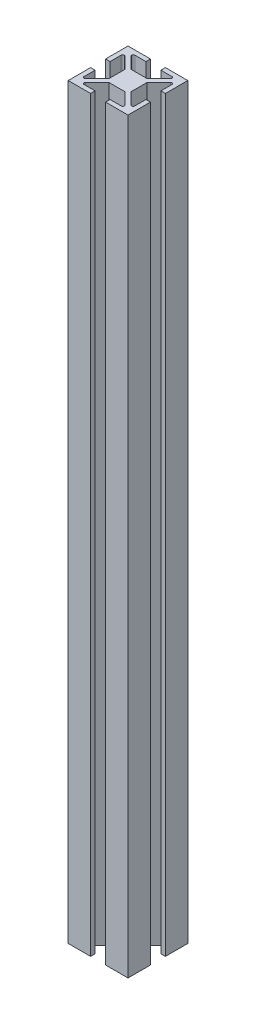
from build123d import *

# Parameters (mm, degrees)
BOSS_EXTRU_1_DEPTH = 250


with BuildPart() as part:
    # Esquisse1 → Boss.-Extru.1 (new body)
    with BuildSketch(Plane(origin=(0, 0, 0), x_dir=(1, 0, 0), z_dir=(0, 1, 0))):
        with BuildLine():
            Line((-10, -2.5), (-10, -10))
            Line((-10, -10), (-2.5, -10))
            Line((-2.5, -10), (-2.5, -8.5))
            Line((-2.5, -8.5), (-6.232233047, -8.5))
            ThreePointArc((-6.232233047, -8.5), (-6.694172813, -8.191341716), (-6.585786438, -7.646446609))
            Line((-6.585786438, -7.646446609), (-2.689339828, -3.75))
            Line((-2.689339828, -3.75), (2.689339828, -3.75))
            Line((2.689339828, -3.75), (6.585786438, -7.646446609))
            ThreePointArc((6.585786438, -7.646446609), (6.694172813, -8.191341716), (6.232233047, -8.5))
            Line((6.232233047, -8.5), (2.5, -8.5))
            Line((2.5, -8.5), (2.5, -10))
            Line((2.5, -10), (10, -10))
            Line((10, -10), (10, -2.5))
            Line((10, -2.5), (8.5, -2.5))
            Line((8.5, -2.5), (8.5, -6.232233047))
            ThreePointArc((8.5, -6.232233047), (8.191341716, -6.694172813), (7.646446609, -6.585786438))
            Line((7.646446609, -6.585786438), (3.75, -2.689339828))
            Line((3.75, -2.689339828), (3.75, 2.689339828))
            Line((3.75, 2.689339828), (7.646446609, 6.585786438))
            ThreePointArc((7.646446609, 6.585786438), (8.191341716, 6.694172813), (8.5, 6.232233047))
            Line((8.5, 6.232233047), (8.5, 2.5))
            Line((8.5, 2.5), (10, 2.5))
            Line((10, 2.5), (10, 10))
            Line((10, 10), (2.5, 10))
            Line((2.5, 10), (2.5, 8.5))
            Line((2.5, 8.5), (6.232233047, 8.5))
            ThreePointArc((6.232233047, 8.5), (6.694172813, 8.191341716), (6.585786438, 7.646446609))
            Line((6.585786438, 7.646446609), (2.689339828, 3.75))
            Line((2.689339828, 3.75), (-2.689339828, 3.75))
            Line((-2.689339828, 3.75), (-6.585786438, 7.646446609))
            ThreePointArc((-6.585786438, 7.646446609), (-6.694172813, 8.191341716), (-6.232233047, 8.5))
            Line((-6.232233047, 8.5), (-2.5, 8.5))
            Line((-2.5, 8.5), (-2.5, 10))
            Line((-2.5, 10), (-10, 10))
            Line((-10, 10), (-10, 2.5))
            Line((-10, 2.5), (-8.5, 2.5))
            Line((-8.5, 2.5), (-8.5, 6.232233047))
            ThreePointArc((-8.5, 6.232233047), (-8.191341716, 6.694172813), (-7.646446609, 6.585786438))
            Line((-7.646446609, 6.585786438), (-3.75, 2.689339828))
            Line((-3.75, 2.689339828), (-3.75, -2.689339828))
            Line((-3.75, -2.689339828), (-7.646446609, -6.585786438))
            ThreePointArc((-7.646446609, -6.585786438), (-8.191341716, -6.694172813), (-8.5, -6.232233047))
            Line((-8.5, -6.232233047), (-8.5, -2.5))
            Line((-8.5, -2.5), (-10, -2.5))
        make_face()
    extrude(amount=BOSS_EXTRU_1_DEPTH)


solid = part.part
